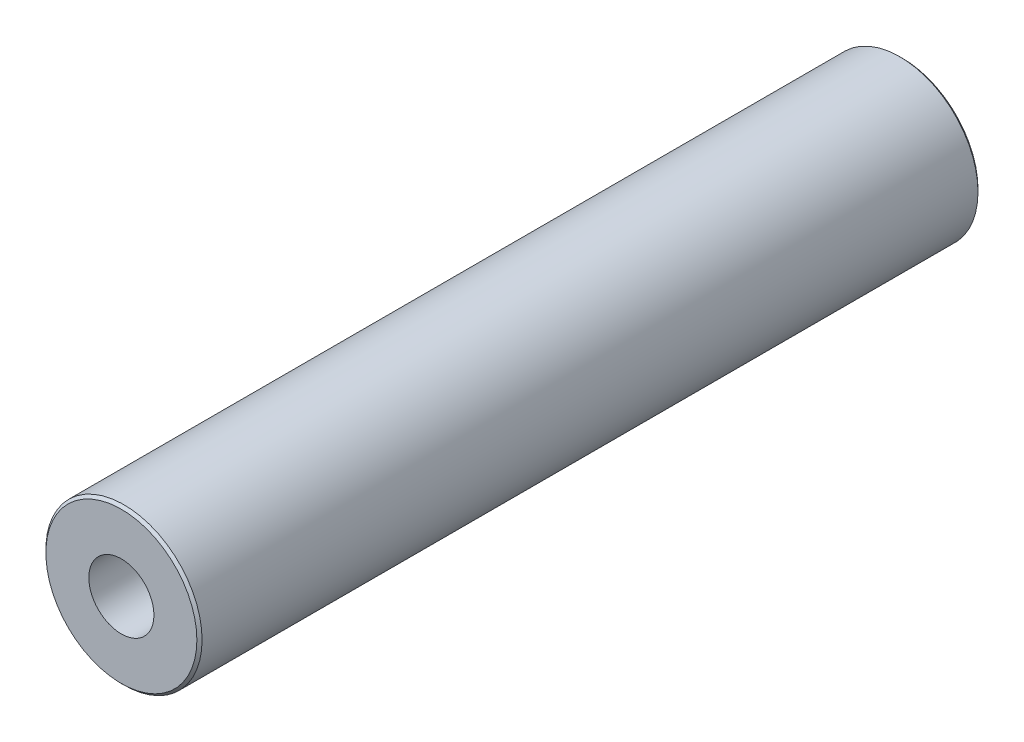
from build123d import *

# Parameters (mm, degrees)
SKETCH_1_R         = 3
EXTRUDE_1_DEPTH    = 15
CHAMFER_1_SIZE     = 0.1
HOLE_WIZARD_M3_1_D = 2.5


with BuildPart() as part:
    # 草图1 → 凸台-拉伸1 (new, symmetric)
    with BuildSketch(Plane.XY):
        Circle(SKETCH_1_R)
    extrude(amount=EXTRUDE_1_DEPTH, both=True)

    # 倒角1
    chamfer_1_edges = [part.edges().sort_by_distance(p)[0] for p in [
        (-3, 0, -15),
        (-3, 0, 15),
    ]]
    chamfer(chamfer_1_edges, length=CHAMFER_1_SIZE)

    # M3 螺纹孔1 (through all)
    with Locations(Plane.XY.offset(15)):
        with Locations((0, 0)):
            Hole(HOLE_WIZARD_M3_1_D / 2)


solid = part.part
